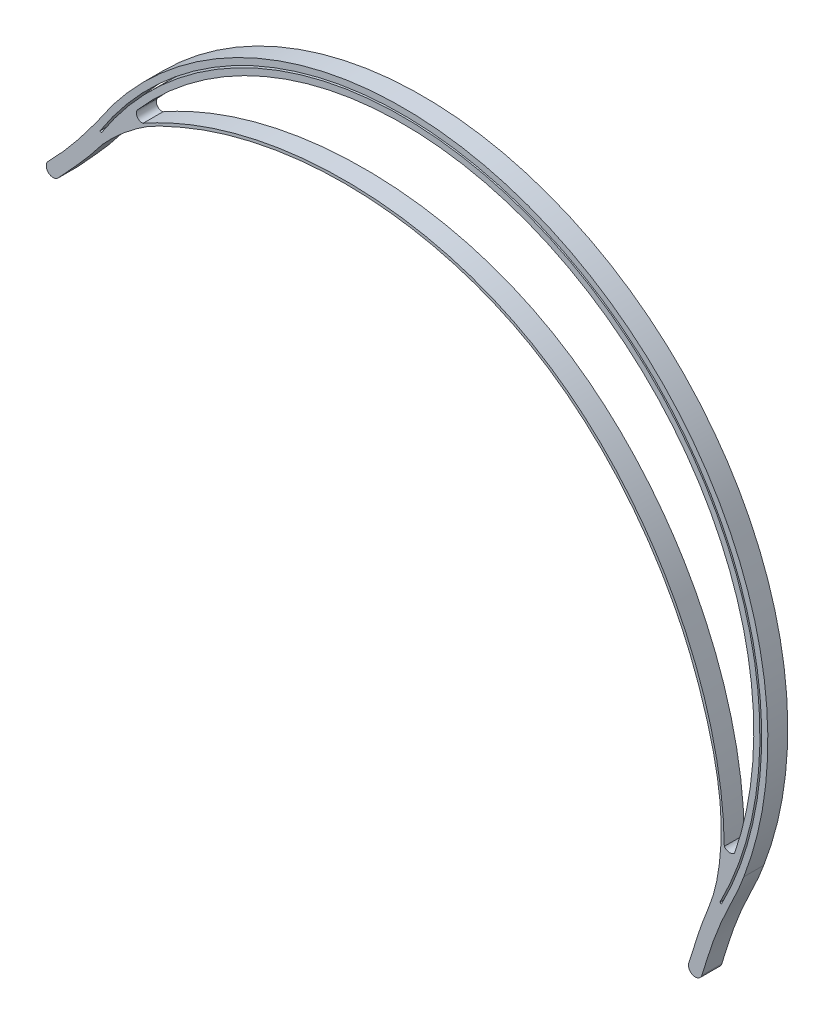
from build123d import *

# Parameters (mm, degrees)
BOSS_EXTRUDE1_DEPTH = 5


with BuildPart() as part:
    # Sketch1 → Boss-Extrude1 (new body)
    with BuildSketch(Plane.XY):
        with BuildLine():
            ThreePointArc((84.470380971, -48.309396238), (43.638048134, 64.380294803), (-73.781213573, 40.31864789))
            add(Edge.make_bspline(
                [(-90.02733784, 19.881960421), (-83.874201822, 26.071652682), (-78.699498785, 33.13753577), (-73.781213573, 40.31864789)],
                knots=[0, 0, 0, 0, 1, 1, 1, 1], degree=3))
            ThreePointArc((-90.02733784, 19.881960421), (-89.958220495, 17.425843549), (-87.503877452, 17.541979342))
            add(Edge.make_bspline(
                [(-87.503877452, 17.541979342), (-84.707848745, 20.763174593), (-80.875808665, 24.457673031), (-77.100895064, 29.677268229), (-74.839704157, 32.087233975), (-71.85147742, 34.986837235), (-68.714037091, 37.49024648), (-64.223773722, 40.597502666), (-59.452469034, 42.768527058), (-54.312810753, 44.987852201), (-50.162496124, 46.516837471), (-41.702999465, 49.262983778), (-25.31788085, 52.65573963), (1.328388845, 52.467049968), (24.503657594, 44.962090487), (38.306193103, 35.847768254), (43.845707521, 31.400008788), (52.162841785, 23.831867626), (61.12315901, 12.799348575), (68.215180794, -0.070098063), (71.827714922, -8.493387961), (76.3358591, -21.281113379), (79.690335488, -35.93150914), (78.372194758, -49.326620865), (76.798949732, -56.996168575), (73.694986911, -63.663654027), (71.816395345, -70.519847269), (70.721693227, -73.809594602)],
                knots=[0, 0, 0, 0, 0.048430887, 0.059753743, 0.072799288, 0.085753855, 0.106855975, 0.118128731, 0.147466192, 0.165856099, 0.181527106, 0.197480849, 0.266491433, 0.369825055, 0.496073427, 0.534748741, 0.556587861, 0.576398069, 0.661959758, 0.715660729, 0.742301896, 0.765537711, 0.86928635, 0.908165754, 0.916998725, 0.957616052, 1, 1, 1, 1], degree=3))
            ThreePointArc((70.721693227, -73.809594602), (71.732341262, -76.059749993), (73.951688954, -74.98313281))
            add(Edge.make_bspline(
                [(84.470380971, -48.309396238), (83.255254604, -51.811304109), (81.022942932, -55.969743945), (78.697368991, -61.207108653), (76.496646715, -66.658047951), (75.100319903, -71.322932257), (73.951688954, -74.98313281)],
                knots=[0, 0, 0, 0, 0.38590798, 0.492307945, 0.598707894, 1, 1, 1, 1], degree=3))
        make_face()
        with BuildLine():
            ThreePointArc((-77.064187816, 32.966722994), (43.908689138, 62.452283522), (78.860179152, -57.055994786))
            Line((78.860179152, -57.055994786), (78.478165831, -56.835439923))
            ThreePointArc((78.478165831, -56.835439923), (43.688355929, 62.07064751), (-76.682168773, 32.746164828))
            Line((-76.682168773, 32.746164828), (-77.064187816, 32.966722994))
        make_face(mode=Mode.SUBTRACT)
        with BuildLine():
            ThreePointArc((-67.603978021, 42.298900066), (-67.556797874, 42.355937333), (-67.506676917, 42.410408481))
            ThreePointArc((-67.506676917, 42.410408481), (43.039648675, 60.663994734), (82.167997548, -44.324841947))
            ThreePointArc((82.167997548, -44.324841947), (80.832703389, -44.832348087), (79.587461659, -44.132386656))
            add(Edge.make_bspline(
                [(79.587461659, -44.132386656), (79.53554652, -39.890731595), (78.852155664, -31.407485468), (75.710361198, -16.444096656), (70.085499498, -1.679875756), (58.733381275, 17.995722424), (43.033146223, 34.799649589), (18.086765419, 48.555811103), (-13.784373464, 55.359872306), (-44.558943338, 50.592122151), (-62.282861867, 42.26867545), (-66.224214366, 40.056250124)],
                knots=[0, 0, 0, 0, 0.062628753, 0.125355314, 0.225241681, 0.294214161, 0.460411112, 0.556083706, 0.711354993, 0.933276475, 1, 1, 1, 1], degree=3))
            ThreePointArc((-66.224214366, 40.056250124), (-67.694709452, 40.697312089), (-67.603978021, 42.298900066))
        make_face(mode=Mode.SUBTRACT)
    extrude(amount=BOSS_EXTRUDE1_DEPTH)


solid = part.part
